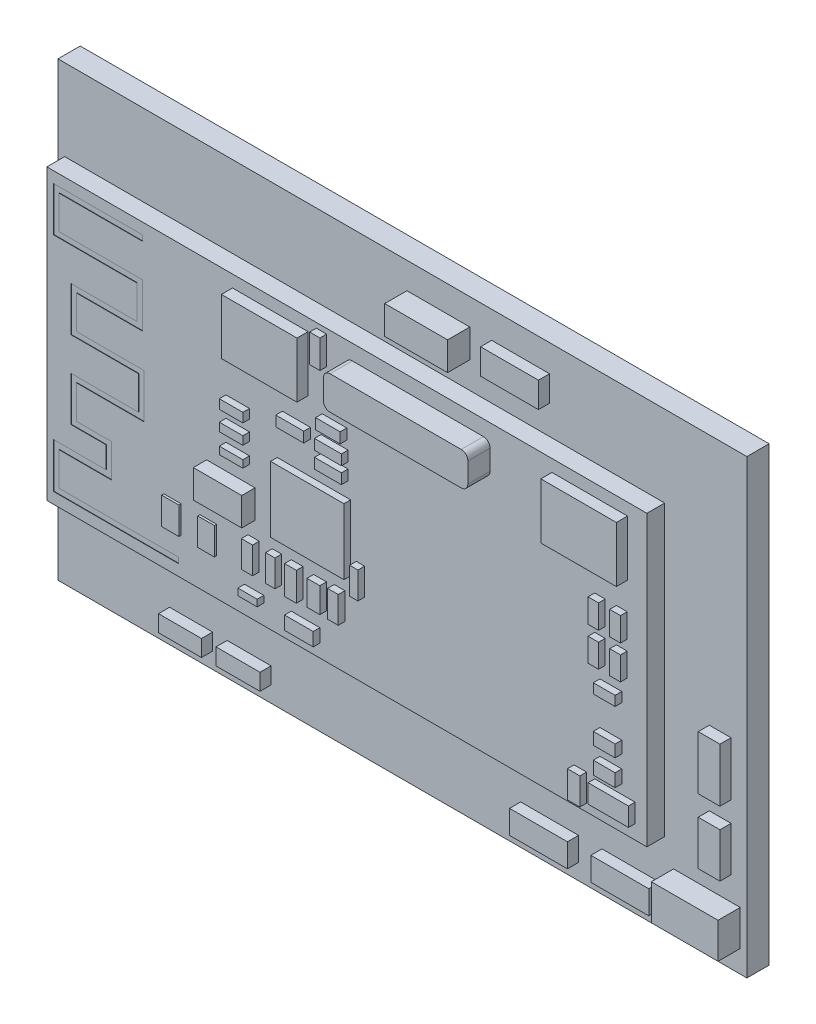
from build123d import *
from build123d.topology import SkipClean

# Parameters (mm, degrees)
SKETCH_1_W          = 48
SKETCH_1_H          = 24
SKETCH_1_R          = 2.1
EXTRUDE_1_DEPTH     = 0.8
FILLET_1_R          = 3
EXTRUDE_START       = 0.01
SKETCH_7_R          = 3
SKETCH_7_R_2        = 2.1
EXTRUDE_4_DEPTH     = 0.01
CUT_EXTRUDE_4_REACH = 28.881
SKETCH_8_R          = 0.9
SKETCH_9_W          = 27
SKETCH_9_H          = 13
EXTRUDE_5_DEPTH     = 0.8
CUT_EXTRUDE_5_DEPTH = 0.02
SKETCH_13_W         = 3.4
SKETCH_13_H         = 2.5
EXTRUDE_7_DEPTH     = 0.5
EXTRUDE_8_DEPTH     = 1
SKETCH_16_W         = 24
SKETCH_16_H         = 24
SKETCH_16_R         = 3
CUT_EXTRUDE_6_DEPTH = 0.01
SKETCH_17_W         = 54.137170876
SKETCH_17_H         = 26.558869756
CUT_EXTRUDE_7_DEPTH = 10
SKETCH_18_W         = 9.76723139
SKETCH_18_H         = 27.16092367
CUT_EXTRUDE_8_DEPTH = 5
SKETCH_19_W         = 31
SKETCH_19_H         = 20.32
EXTRUDE_10_DEPTH    = 1
SKETCH_20_W         = 3
SKETCH_20_H         = 1.6
EXTRUDE_11_DEPTH    = 1
SKETCH_21_W         = 2.828727218
SKETCH_21_H         = 1.279662313
EXTRUDE_12_DEPTH    = 1
SKETCH_22_W         = 3.300730108
SKETCH_22_H         = 2.962506044
SKETCH_22_W_2       = 0.372699524
SKETCH_22_H_2       = 1.206773295
SKETCH_22_W_3       = 0.504516239
SKETCH_22_H_3       = 1.201229141
SKETCH_22_W_4       = 0.420430199
SKETCH_22_W_5       = 0.528540822
SKETCH_22_H_4       = 1.285315181
SKETCH_22_W_6       = 0.576589988
SKETCH_22_H_5       = 1.129155392
SKETCH_22_W_7       = 0.480491656
SKETCH_22_W_8       = 1.285315181
SKETCH_22_H_6       = 0.600614571
SKETCH_22_W_9       = 0.868724159
SKETCH_22_H_7       = 0.300307286
SKETCH_22_W_10      = 2.179510154
SKETCH_22_H_8       = 1.266191613
SKETCH_22_W_11      = 1.058619218
SKETCH_22_H_9       = 0.332115833
SKETCH_22_H_10      = 0.373630312
SKETCH_22_H_11      = 0.415144791
SKETCH_22_W_12      = 1.103790935
SKETCH_22_H_12      = 0.474748789
SKETCH_22_W_13      = 0.46288007
SKETCH_22_H_13      = 1.269953012
SKETCH_22_W_14      = 1.210609413
SKETCH_22_H_14      = 0.46288007
SKETCH_22_W_15      = 1.258084292
EXTRUDE_13_DEPTH    = 0.3
SKETCH_23_W         = 2.605136796
SKETCH_23_H         = 1.054460132
SKETCH_23_W_2       = 1.934163898
SKETCH_23_H_2       = 0.74347258
SKETCH_23_W_3       = 1.977791655
SKETCH_23_H_3       = 1.147500732
SKETCH_23_W_4       = 0.97816684
SKETCH_23_H_4       = 2.419675867
SKETCH_23_H_5       = 2.003844273
EXTRUDE_14_DEPTH    = 0.5
SKETCH_24_W         = 2.179510154
SKETCH_24_H         = 1.266191613
EXTRUDE_15_DEPTH    = 0.3
SKETCH_25_W         = 0.749909735
SKETCH_25_H         = 1.227125021
SKETCH_25_W_2       = 0.77717918
EXTRUDE_16_DEPTH    = 0.1
SKETCH_26_W         = 0.470457146
SKETCH_26_H         = 1.070695575
SKETCH_26_W_2       = 0.486679807
SKETCH_26_H_2       = 1.054472914
SKETCH_26_W_3       = 0.981470944
SKETCH_26_H_3       = 0.438011826
SKETCH_26_H_4       = 0.542413439
SKETCH_26_H_5       = 0.583877092
SKETCH_26_W_4       = 1.817725219
SKETCH_26_H_6       = 0.835745642
SKETCH_26_W_5       = 0.560979952
SKETCH_26_H_7       = 1.213548468
EXTRUDE_17_DEPTH    = 0.3


with BuildPart() as part:
    # 草图1 → 凸台-拉伸1 (new, symmetric)
    with BuildSketch(Plane.XY):
        Rectangle(SKETCH_1_W, SKETCH_1_H)
        with Locations((8, 8)):
            Circle(SKETCH_1_R, mode=Mode.SUBTRACT)
        with Locations((8, -8)):
            Circle(SKETCH_1_R, mode=Mode.SUBTRACT)
    extrude(amount=EXTRUDE_1_DEPTH, both=True)

    # 圆角1
    fillet_1_edges = [part.edges().sort_by_distance(p)[0] for p in [
        (24, -12, 0),
        (-24, -12, 0),
        (-24, 12, 0),
        (24, 12, 0),
    ]]
    fillet(fillet_1_edges, radius=FILLET_1_R)

    # 草图7 → 凸台-拉伸4 (add)
    # profile 1 of 2: a face of its own
    with SkipClean():  # the faces are left unmerged after this step: merging them gives an invalid solid
        with BuildSketch(Plane(origin=(0, 0, -0.8), x_dir=(-1, 0, 0), z_dir=(0, 0, -1)).offset(EXTRUDE_START)):
            with Locations(Location((-8, 8, 0), (0, 0, 180))):
                Circle(SKETCH_7_R)
            with Locations((-8, 8)):
                Circle(SKETCH_7_R_2, mode=Mode.SUBTRACT)
        # profile 2 of 2: a face of its own
        with BuildSketch(Plane(origin=(0, 0, -0.8), x_dir=(-1, 0, 0), z_dir=(0, 0, -1)).offset(EXTRUDE_START)):
            with Locations(Location((-8, -8, 0), (0, 0, 180))):
                Circle(SKETCH_7_R)
            with Locations((-8, -8)):
                Circle(SKETCH_7_R_2, mode=Mode.SUBTRACT)
        extrude_4 = extrude(amount=-EXTRUDE_4_DEPTH)

    # 镜向1: 凸台-拉伸4 across plane
    add(extrude_4.mirror(Plane.XY))

    # 草图8 → 切除-拉伸4 (cut, up to next)
    with BuildSketch(Plane.XY.offset(0.8), mode=Mode.PRIVATE) as cut_extrude_4_sk1:
        with Locations((21.46, 7)):
            Circle(SKETCH_8_R)
    cut_extrude_4_tool1 = extrude(cut_extrude_4_sk1.sketch, amount=-CUT_EXTRUDE_4_REACH, mode=Mode.PRIVATE) & part.part
    # 草图8 → 切除-拉伸4 (cut, up to next)
    with BuildSketch(Plane.XY.offset(0.8), mode=Mode.PRIVATE) as cut_extrude_4_sk2:
        with Locations((21.46, -5)):
            Circle(SKETCH_8_R)
    cut_extrude_4_tool2 = extrude(cut_extrude_4_sk2.sketch, amount=-CUT_EXTRUDE_4_REACH, mode=Mode.PRIVATE) & part.part
    add(cut_extrude_4_tool1.solids().sort_by_distance((21.46, 7, 0.8))[0], mode=Mode.SUBTRACT)
    add(cut_extrude_4_tool2.solids().sort_by_distance((21.46, -5, 0.8))[0], mode=Mode.SUBTRACT)

    # 草图9 → 凸台-拉伸5 (add)
    with BuildSketch(Plane.XY.offset(0.8)):
        with Locations((-10.4, 0)):
            Rectangle(SKETCH_9_W, SKETCH_9_H)
    extrude(amount=EXTRUDE_5_DEPTH)

    # 草图12 → 切除-拉伸5 (cut)
    with BuildSketch(Plane.XY.offset(1.6)):
        Polygon((-19.605022667, 6), (-23.605022667, 6), (-23.605022667, 4), (-19.855022667, 4), (-19.855022667, 2.5), (-22.81887095, 2.5), (-22.81887095, 0.5), (-19.783231036, 0.5), (-19.783231036, -1), (-22.81887095, -1), (-22.81887095, -3), (-21.235497882, -3), (-21.235497882, -3.973437751), (-23.605022667, -3.973437751), (-23.605022667, -6), (-17.982786515, -6), (-17.982786515, -5.75), (-23.355022667, -5.75), (-23.355022667, -4.25), (-20.985497882, -4.25), (-20.985497882, -2.75), (-22.56887095, -2.75), (-22.56887095, -1.25), (-19.525734721, -1.25), (-19.525734721, 0.75), (-22.56887095, 0.75), (-22.56887095, 2.25), (-19.605022667, 2.25), (-19.605022667, 4.25), (-23.355022667, 4.25), (-23.355022667, 5.75), (-19.605022667, 5.75), align=None)
    extrude(amount=-CUT_EXTRUDE_5_DEPTH, mode=Mode.SUBTRACT)

    # 草图13 → 凸台-拉伸7 (add)
    with BuildSketch(Plane.XY.offset(1.6)):
        with Locations((0.526786095, 4.705979324)):
            Rectangle(SKETCH_13_W, SKETCH_13_H)
        with Locations((-13.846669284, 4.705979324)):
            Rectangle(SKETCH_13_W, SKETCH_13_H)
    extrude(amount=EXTRUDE_7_DEPTH)

    # 草图14 → 凸台-拉伸8 (add)
    with BuildSketch(Plane.XY.offset(1.6)):
        with BuildLine():
            Line((-10.157044643, 5.809454865), (-4.257044643, 5.809454865))
            ThreePointArc((-4.257044643, 5.809454865), (-4.044912608, 5.721586899), (-3.957044643, 5.509454865))
            Line((-3.957044643, 5.509454865), (-3.957044643, 4.609454865))
            ThreePointArc((-3.957044643, 4.609454865), (-4.044912608, 4.397322831), (-4.257044643, 4.309454865))
            Line((-4.257044643, 4.309454865), (-10.157044643, 4.309454865))
            ThreePointArc((-10.157044643, 4.309454865), (-10.369176677, 4.397322831), (-10.457044643, 4.609454865))
            Line((-10.457044643, 4.609454865), (-10.457044643, 5.509454865))
            ThreePointArc((-10.457044643, 5.509454865), (-10.369176677, 5.721586899), (-10.157044643, 5.809454865))
        make_face()
    extrude(amount=EXTRUDE_8_DEPTH)

    # 草图16 → 切除-拉伸6 (cut)
    with BuildSketch(Plane(origin=(0, 0, -0.8), x_dir=(-1, 0, 0), z_dir=(0, 0, -1))):
        Rectangle(SKETCH_16_W, SKETCH_16_H)
        with Locations(Location((-8, 8, 0), (0, 0, 180))):
            Circle(SKETCH_16_R, mode=Mode.SUBTRACT)
        with Locations(Location((-8, -8, 0), (0, 0, 180))):
            Circle(SKETCH_16_R, mode=Mode.SUBTRACT)
    extrude(amount=-CUT_EXTRUDE_6_DEPTH, mode=Mode.SUBTRACT)

    # 草图17 → 切除-拉伸7 (cut)
    with BuildSketch(Plane.XY.offset(0.8)):
        Rectangle(SKETCH_17_W, SKETCH_17_H)
    extrude(amount=-CUT_EXTRUDE_7_DEPTH, mode=Mode.SUBTRACT)


with BuildPart() as cut_extrude_7_piece_1:
    # of the separate pieces the step leaves, piece 1, a body of its own (cut_extrude_7_pieces)
    add(part.part.solids().sort_by_distance((3.1, 6.5, 0.8))[0])

    # 草图19 → 凸台-拉伸10 (add)
    with BuildSketch(Plane(origin=(0, 0, 0.8), x_dir=(-1, 0, 0), z_dir=(0, 0, -1))):
        with Locations((8.7, 0)):
            Rectangle(SKETCH_19_W, SKETCH_19_H)
    extrude(amount=EXTRUDE_10_DEPTH)

    # 草图20 → 凸台-拉伸11 (add)
    with BuildSketch(Plane.XY.offset(0.8)):
        with Locations((5, -8.36)):
            Rectangle(SKETCH_20_W, SKETCH_20_H)
    extrude(amount=EXTRUDE_11_DEPTH)

    # 草图21 → 凸台-拉伸12 (add)
    with BuildSketch(Plane.XY.offset(0.8)):
        with Locations((-7.083584447, 8.334642696)):
            Rectangle(SKETCH_21_W, SKETCH_21_H)
    extrude(amount=EXTRUDE_12_DEPTH)

    # 草图22 → 凸台-拉伸13 (add)
    with BuildSketch(Plane.XY.offset(1.6)):
        with Locations((-11.883103823, -1.123736092)):
            Rectangle(SKETCH_22_W, SKETCH_22_H)
        with Locations((-9.78919521, -2.515773548)):
            Rectangle(SKETCH_22_W_2, SKETCH_22_H_2)
        with Locations((-14.597122376, -3.910424328)):
            Rectangle(SKETCH_22_W_3, SKETCH_22_H_3)
        with Locations((-13.546046878, -3.910424328)):
            Rectangle(SKETCH_22_W_4, SKETCH_22_H_3)
        with Locations((-12.639118876, -3.952467348)):
            Rectangle(SKETCH_22_W_5, SKETCH_22_H_4)
        with Locations((-11.606061814, -3.946461202)):
            Rectangle(SKETCH_22_W_6, SKETCH_22_H_5)
        with Locations((-10.729164541, -3.910424328)):
            Rectangle(SKETCH_22_W_7, SKETCH_22_H_3)
        with Locations((-12.260731697, -5.616169709)):
            Rectangle(SKETCH_22_W_8, SKETCH_22_H_6)
        with Locations((-14.571178205, -5.466016066)):
            Rectangle(SKETCH_22_W_9, SKETCH_22_H_7)
        with Locations((-15.622318703, -1.956915282)):
            Rectangle(SKETCH_22_W_10, SKETCH_22_H_8)
        with Locations((-15.310960109, -0.368986455)):
            Rectangle(SKETCH_22_W_11, SKETCH_22_H_9)
        with Locations((-15.310960109, 0.544332086)):
            Rectangle(SKETCH_22_W_11, SKETCH_22_H_10)
        with Locations((-15.310960109, 1.436893388)):
            Rectangle(SKETCH_22_W_11, SKETCH_22_H_11)
        with Locations((-10.956517839, 2.836165243)):
            Rectangle(SKETCH_22_W_12, SKETCH_22_H_12)
        with Locations((-11.544393591, 5.64041455)):
            Rectangle(SKETCH_22_W_13, SKETCH_22_H_13)
        with Locations((-10.952578752, 2.007331225)):
            Rectangle(SKETCH_22_W_14, SKETCH_22_H_14)
        with Locations((-10.952578752, 1.271470601)):
            Rectangle(SKETCH_22_W_14, SKETCH_22_H_14)
        with Locations((-12.671547841, 2.046895381)):
            Rectangle(SKETCH_22_W_15, SKETCH_22_H_14)
    extrude(amount=EXTRUDE_13_DEPTH)

    # 草图23 → 凸台-拉伸14 (add)
    with BuildSketch(Plane.XY.offset(0.8)):
        with Locations((1.580986284, -8.916390819)):
            Rectangle(SKETCH_23_W, SKETCH_23_H)
        with Locations((-2.078610644, -8.916390819)):
            Rectangle(SKETCH_23_W, SKETCH_23_H)
        with Locations((-18.209897828, -9.071884595)):
            Rectangle(SKETCH_23_W_2, SKETCH_23_H_2)
        with Locations((-15.599503696, -9.071884595)):
            Rectangle(SKETCH_23_W_3, SKETCH_23_H_2)
        with Locations((-3.381179042, 8.373653987)):
            Rectangle(SKETCH_23_W, SKETCH_23_H_3)
        with Locations((5.597479199, -2.363843754)):
            Rectangle(SKETCH_23_W_4, SKETCH_23_H_4)
        with Locations((5.597479199, -5.49193501)):
            Rectangle(SKETCH_23_W_4, SKETCH_23_H_5)
    extrude(amount=EXTRUDE_14_DEPTH)

    # 草图24 → 凸台-拉伸15 (add)
    with BuildSketch(Plane.XY.offset(1.9)):
        with Locations((-15.622318703, -1.956915282)):
            Rectangle(SKETCH_24_W, SKETCH_24_H)
    extrude(amount=EXTRUDE_15_DEPTH)

    # 草图25 → 凸台-拉伸16 (add)
    with BuildSketch(Plane.XY.offset(1.6)):
        with Locations((-16.638318289, -4.222827167)):
            Rectangle(SKETCH_25_W, SKETCH_25_H)
        with Locations((-18.247215539, -4.222827167)):
            Rectangle(SKETCH_25_W_2, SKETCH_25_H)
    extrude(amount=EXTRUDE_16_DEPTH)

    # 草图26 → 凸台-拉伸17 (add)
    with BuildSketch(Plane.XY.offset(1.6)):
        with Locations((0.987677715, 1.684080322)):
            Rectangle(SKETCH_26_W, SKETCH_26_H)
        with Locations((1.969148659, 1.684080322)):
            Rectangle(SKETCH_26_W_2, SKETCH_26_H)
        with Locations((0.987677715, 0.15915026)):
            Rectangle(SKETCH_26_W, SKETCH_26_H_2)
        with Locations((1.969148659, 0.15915026)):
            Rectangle(SKETCH_26_W_2, SKETCH_26_H_2)
        with Locations((1.478413187, -1.227887189)):
            Rectangle(SKETCH_26_W_3, SKETCH_26_H_3)
        with Locations((1.478413187, -3.176441667)):
            Rectangle(SKETCH_26_W_3, SKETCH_26_H_4)
        with Locations((1.478413187, -4.318505868)):
            Rectangle(SKETCH_26_W_3, SKETCH_26_H_5)
        with Locations((1.661311752, -5.440465772)):
            Rectangle(SKETCH_26_W_4, SKETCH_26_H_6)
        with Locations((0.10300743, -5.549227191)):
            Rectangle(SKETCH_26_W_5, SKETCH_26_H_7)
    extrude(amount=EXTRUDE_17_DEPTH)


with BuildPart() as cut_extrude_7_piece_2:
    # of the separate pieces the step leaves, piece 2, a body of its own (cut_extrude_7_pieces)
    add(part.part.solids().sort_by_distance((11, -8, 0.81))[0])


with BuildPart() as cut_extrude_7_piece_3:
    # of the separate pieces the step leaves, piece 3, a body of its own (cut_extrude_7_pieces)
    add(part.part.solids().sort_by_distance((11, 8, 0.81))[0])


with BuildPart() as cut_extrude_8_tool:
    # 草图18 → 切除-拉伸8 (new, symmetric)
    with BuildSketch(Plane.XY.offset(1.6)):
        with Locations((9.033954098, -1.178809672)):
            Rectangle(SKETCH_18_W, SKETCH_18_H)
    extrude(amount=CUT_EXTRUDE_8_DEPTH, both=True)


with BuildPart() as cut_extrude_7_piece_2_1:
    add(cut_extrude_7_piece_2.part)

    # 切除-拉伸8: cut by cut_extrude_8_tool
    add(cut_extrude_8_tool.part, mode=Mode.SUBTRACT)


with BuildPart() as cut_extrude_7_piece_3_1:
    add(cut_extrude_7_piece_3.part)

    # 切除-拉伸8: cut by cut_extrude_8_tool
    add(cut_extrude_8_tool.part, mode=Mode.SUBTRACT)


solid = cut_extrude_7_piece_1.part
